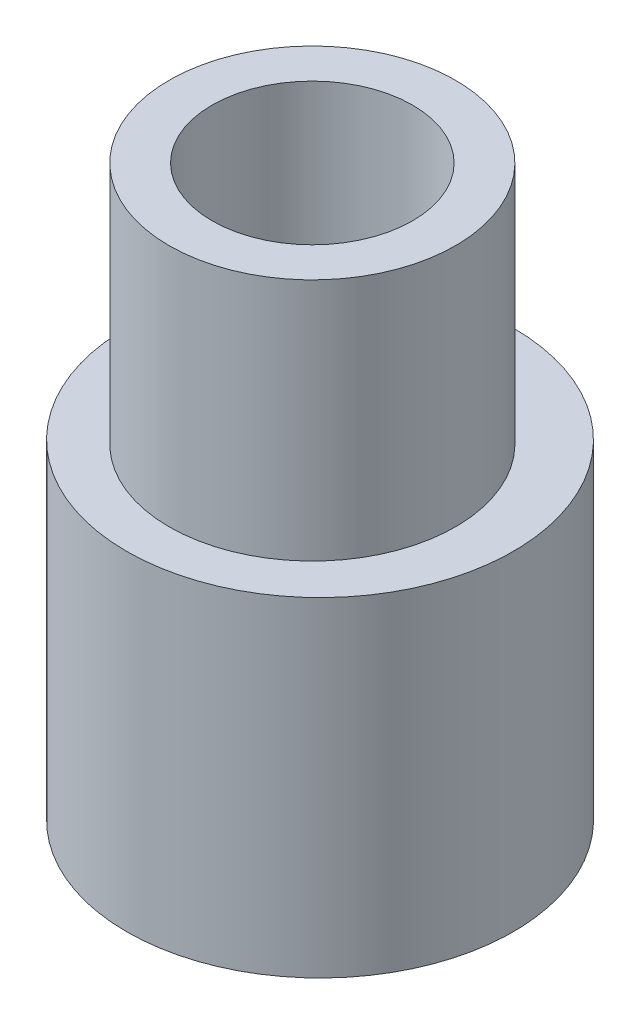
from build123d import *

# Parameters (mm, degrees)
SKETCH1_R           = 2.54
BOSS_EXTRUDE1_DEPTH = 4.318
SKETCH2_R           = 1.778
CUT_EXTRUDE1_DEPTH  = 3.048
SKETCH4_R           = 3.429
BOSS_EXTRUDE2_DEPTH = 5.842
SKETCH5_R           = 2.794
CUT_EXTRUDE2_DEPTH  = 4.826


with BuildPart() as part:
    # Sketch1 → Boss-Extrude1 (new body)
    with BuildSketch(Plane(origin=(0, 0, 0), x_dir=(1, 0, 0), z_dir=(0, 1, 0))):
        with Locations(Location((0, 0, 0), (0, 0, 270))):
            Circle(SKETCH1_R)
    extrude(amount=BOSS_EXTRUDE1_DEPTH)

    # Sketch2 → Cut-Extrude1 (cut)
    with BuildSketch(Plane(origin=(0, 4.318, 0), x_dir=(1, 0, 0), z_dir=(0, 1, 0))):
        with Locations(Location((0, 0, 0), (0, 0, 270))):
            Circle(SKETCH2_R)
    extrude(amount=-CUT_EXTRUDE1_DEPTH, mode=Mode.SUBTRACT)

    # Sketch4 → Boss-Extrude2 (add)
    with BuildSketch(Plane.XZ):
        with Locations(Location((0, -0.136069794, 0), (0, 0, 270))):
            Circle(SKETCH4_R)
    extrude(amount=BOSS_EXTRUDE2_DEPTH)

    # Sketch5 → Cut-Extrude2 (cut)
    with BuildSketch(Plane.XZ.offset(5.842)):
        with Locations(Location((0, 0, 0), (0, 0, 270))):
            Circle(SKETCH5_R)
    extrude(amount=-CUT_EXTRUDE2_DEPTH, mode=Mode.SUBTRACT)


solid = part.part
